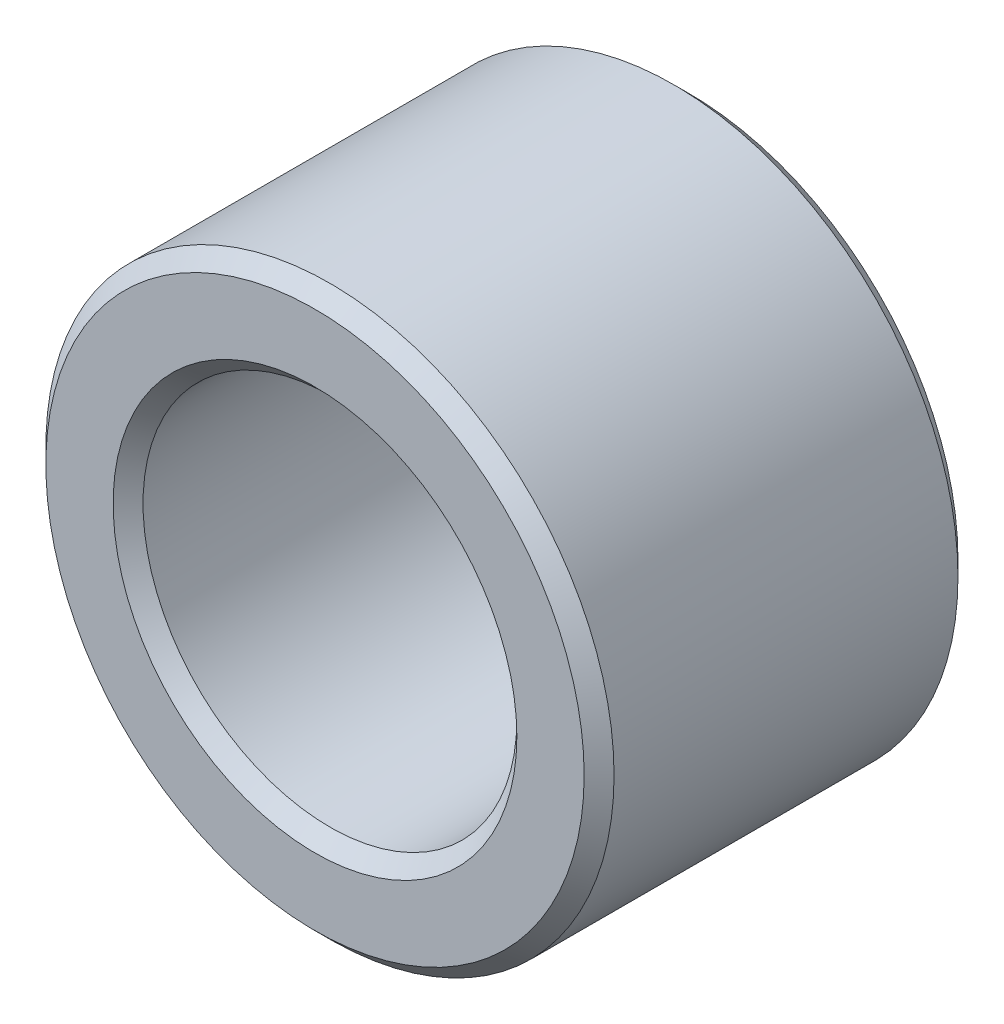
from build123d import *

# Parameters (mm, degrees)
SKETCH1_R           = 4.826
SKETCH1_R_2         = 3.175
BOSS_EXTRUDE1_DEPTH = 6.35
CHAMFER1_SIZE       = 0.254


with BuildPart() as part:
    # Sketch1 → Boss-Extrude1 (new body)
    with BuildSketch(Plane.XY):
        Circle(SKETCH1_R)
        Circle(SKETCH1_R_2, mode=Mode.SUBTRACT)
    extrude(amount=BOSS_EXTRUDE1_DEPTH)

    # Chamfer1
    chamfer1_edges = [part.edges().sort_by_distance(p)[0] for p in [
        (-4.826, 0, 0),
        (-4.826, 0, 6.35),
        (-3.175, 0, 0),
        (-3.175, 0, 6.35),
    ]]
    chamfer(chamfer1_edges, length=CHAMFER1_SIZE)


solid = part.part
